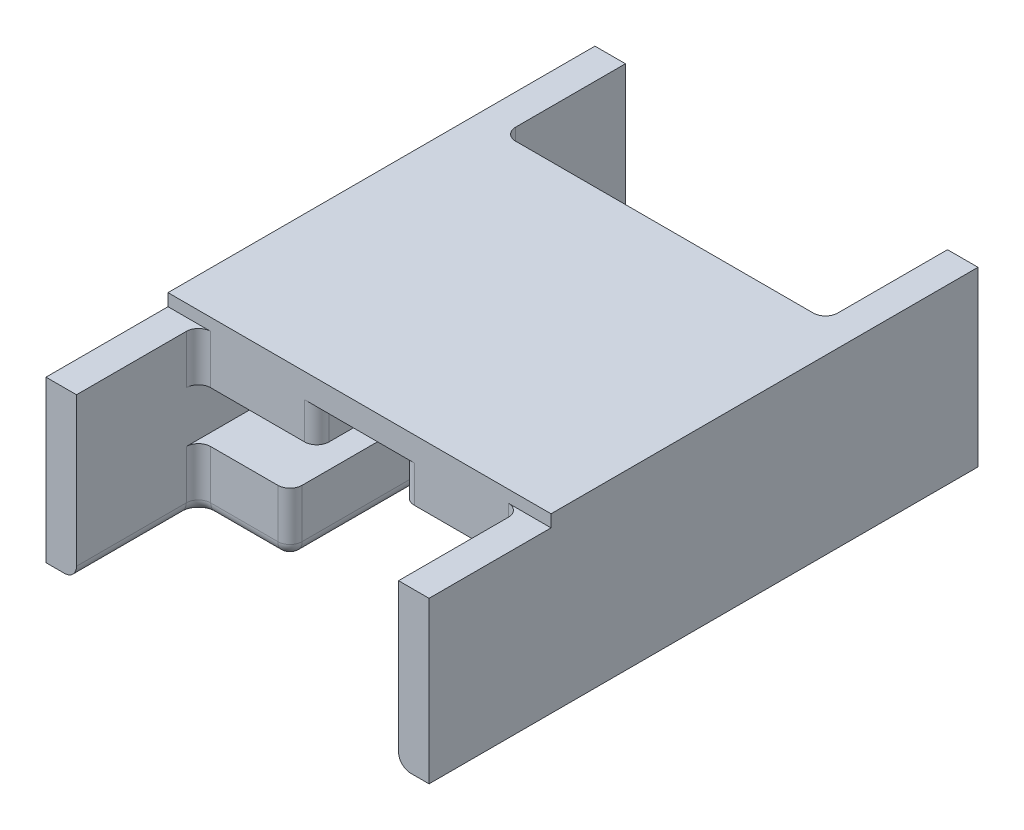
from build123d import *

# Parameters (mm, degrees)
BOSS_EXTRUDE1_DEPTH = 50
SKETCH2_W           = 5
SKETCH2_H           = 26.35
BOSS_EXTRUDE2_DEPTH = 20
SKETCH4_W           = 5
SKETCH4_H           = 28.35
BOSS_EXTRUDE3_DEPTH = 20
FILLET2_R           = 2


with BuildPart() as part:
    # Sketch1 → Boss-Extrude1 (new body)
    with BuildSketch(Plane.XY):
        Polygon((-35.507131788, 10.549060403), (-35.507131788, -17.800939597), (-15.507131788, -17.800939597), (-15.507131788, -7.800939597), (-30.507131788, -7.800939597), (-30.507131788, 0.549060403), (-11.107131788, 0.549060403), (-11.107131788, 6.549060403), (2.892868212, 6.549060403), (2.892868212, 0.549060403), (22.292868212, 0.549060403), (22.292868212, -7.800939597), (7.292868212, -7.800939597), (7.292868212, -17.800939597), (27.292868212, -17.800939597), (27.292868212, 10.549060403), align=None)
    extrude(amount=-BOSS_EXTRUDE1_DEPTH)

    # Sketch2 → Boss-Extrude2 (add)
    with BuildSketch(Plane.XY):
        with Locations((-33.007131788, -4.625939597)):
            Rectangle(SKETCH2_W, SKETCH2_H)
        with Locations((24.792868212, -4.625939597)):
            Rectangle(SKETCH2_W, SKETCH2_H)
    extrude(amount=BOSS_EXTRUDE2_DEPTH)

    # Sketch4 → Boss-Extrude3 (add)
    with BuildSketch(Plane(origin=(0, 0, -50), x_dir=(-1, 0, 0), z_dir=(0, 0, -1))):
        with Locations((-24.792868212, -3.625939597)):
            Rectangle(SKETCH4_W, SKETCH4_H)
        with Locations((33.007131788, -3.625939597)):
            Rectangle(SKETCH4_W, SKETCH4_H)
    extrude(amount=BOSS_EXTRUDE3_DEPTH)

    # Fillet2
    fillet2_edges = [part.edges().sort_by_distance(p)[0] for p in [
        (14.792868212, -17.800939597, 0),
        (7.292868212, -12.800939597, 0),
        (-15.507131788, -12.800939597, -50),
        (2.892868212, 3.549060403, 0),
        (-11.107131788, 3.549060403, 0),
        (-15.507131788, -12.800939597, 0),
        (7.292868212, -17.800939597, -25),
        (-15.507131788, -17.800939597, -25),
        (-11.107131788, 3.549060403, -50),
        (2.892868212, 3.549060403, -50),
        (-23.007131788, -17.800939597, 0),
        (-30.507131788, -12.800939597, 0),
        (-30.507131788, -17.800939597, 10),
        (-30.507131788, 4.549060403, 0),
        (7.292868212, -12.800939597, -50),
        (22.292868212, 4.549060403, 0),
        (22.292868212, -12.800939597, 0),
        (22.292868212, -17.800939597, 10),
        (14.792868212, -17.800939597, -50),
        (22.292868212, 5.549060403, -50),
        (22.292868212, -12.800939597, -50),
        (22.292868212, -17.800939597, -60),
        (-23.007131788, -17.800939597, -50),
        (-30.507131788, -12.800939597, -50),
        (-30.507131788, 5.549060403, -50),
        (-30.507131788, -17.800939597, -60),
    ]]
    fillet(fillet2_edges, radius=FILLET2_R)


solid = part.part
